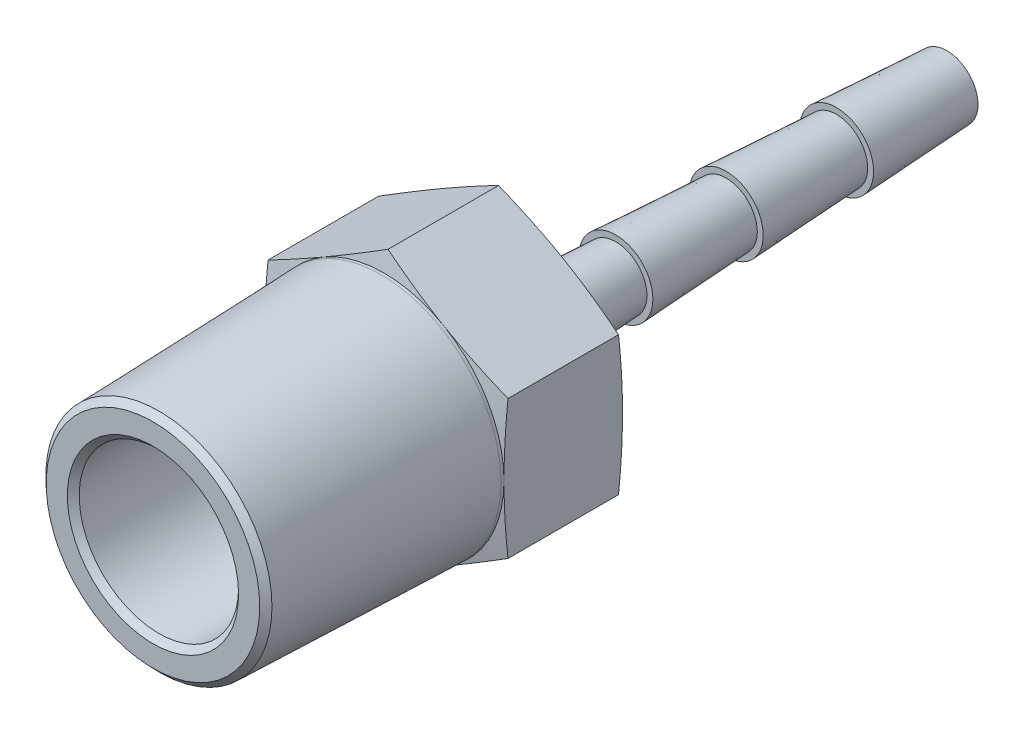
from build123d import *
from OCP.BRepFilletAPI import BRepFilletAPI_MakeChamfer

# Parameters (mm, degrees)
PIPESKETCH_R        = 5.1435
PIPESKETCH_R_2      = 1.0795
EXTRUSION_DEPTH     = 34.036
SKETCH1_R           = 1.0795
BOSS_EXTRUDE1_DEPTH = 5.08
SKETCH9_R           = 3.4163
CUT_EXTRUDE1_DEPTH  = 9.906
CHAMFER1_SIZE       = 0.254
CHAMFER1_SIZE2      = 0.262273252


with BuildPart() as part:
    # PipeSketch → Extrusion (new body)
    with BuildSketch(Plane.XY):
        Circle(PIPESKETCH_R)
        Circle(PIPESKETCH_R_2, mode=Mode.SUBTRACT)
    extrude(amount=EXTRUSION_DEPTH)

    # Sketch1 → Boss-Extrude1 (add)
    with BuildSketch(Plane.XY.offset(19.05)):
        Polygon((5.1435, 2.96960111), (0, 5.939202219), (-5.1435, 2.96960111), (-5.1435, -2.96960111), (0, -5.939202219), (5.1435, -2.96960111), align=None)
        Circle(SKETCH1_R, mode=Mode.SUBTRACT)
    extrude(amount=BOSS_EXTRUDE1_DEPTH)

    # Sketch9 → Cut-Extrude1 (cut)
    with BuildSketch(Plane.XY.offset(34.036)):
        Circle(SKETCH9_R)
    extrude(amount=-CUT_EXTRUDE1_DEPTH, mode=Mode.SUBTRACT)

    # Sketch7 → Cut-Revolve7 (revolve, cut)
    with BuildSketch(Plane(origin=(0, 0, 0), x_dir=(0, 0, -1), z_dir=(1, 0, 0))):
        Polygon((-34.036, 5.1435), (-34.036, 4.839599393), (-24.257, 5.1435), align=None)
        Polygon((0, 5.1435), (-19.05, 5.1435), (-19.05, 1.5875), (-18.923, 1.5875), (-14.19225, 1.3335), (-14.19225, 1.5875), (-9.4615, 1.3335), (-9.4615, 1.5875), (-4.73075, 1.3335), (-4.73075, 1.5875), (0, 1.3335), align=None)
    revolve(axis=Axis((0, 0, 0), (0, 0, -1)), mode=Mode.SUBTRACT)

    # Sketch4 → Cut-Revolve6 (revolve, cut)
    with BuildSketch(Plane(origin=(0, 0, 0), x_dir=(1, 0, 0), z_dir=(0, 1, 0))):
        Polygon((-5.1435, -24.13), (-14.0335, -24.13), (-14.0335, -22.225), align=None)
        Polygon((-5.1435, -19.05), (-14.0335, -19.05), (-14.0335, -20.955), align=None)
    revolve(axis=Axis((0, 0, 0), (0, 0, 1)), mode=Mode.SUBTRACT)

    # Chamfer1: one chamfer whose edges measure the first distance from different faces: ONE call of the kernel's chamfer builder (chamfer() names one face for all edges)
    chamfer1_edges_1 = [part.edges().sort_by_distance(p)[0] for p in [
        (0, -4.839599393, 34.036),
    ]]
    chamfer1_side_1 = [part.faces().sort_by_distance(p)[0] for p in [
        (0, -4.991549697, 29.1465),
    ]]
    chamfer1_edges_2 = [part.edges().sort_by_distance(p)[0] for p in [
        (-3.4163, 0, 34.036),
    ]]
    chamfer1 = BRepFilletAPI_MakeChamfer(part.part.solid().wrapped)
    for e in chamfer1_edges_1:
        chamfer1.Add(CHAMFER1_SIZE, CHAMFER1_SIZE2, e.wrapped, chamfer1_side_1[0].wrapped)  # the first distance lies on this face
    for e in chamfer1_edges_2:
        chamfer1.Add(CHAMFER1_SIZE, e.wrapped)
    add(Compound.cast(chamfer1.Shape()), mode=Mode.REPLACE)


solid = part.part
